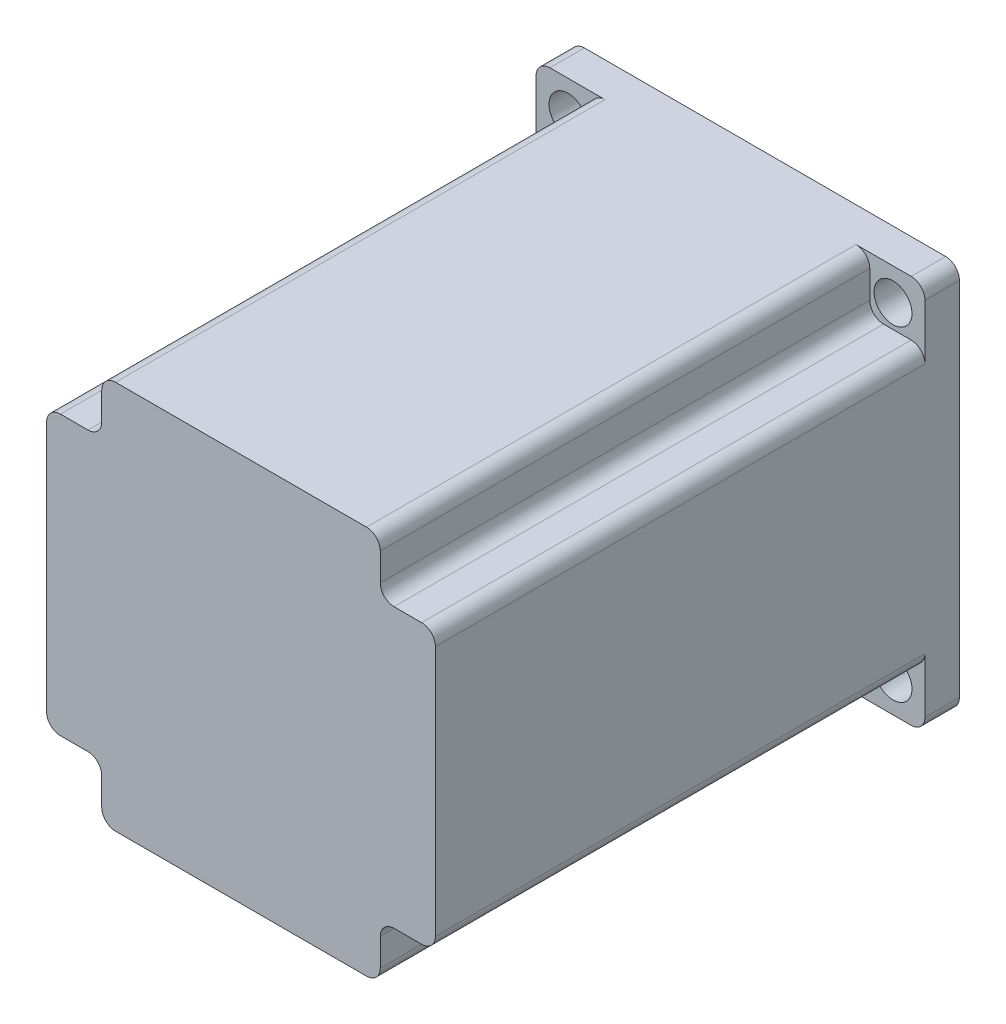
from build123d import *

# Parameters (mm, degrees)
SKETCH1_W        = 56.4
SKETCH1_H        = 56.4
EXTRUSION1_DEPTH = 76
THREAD4_D        = 5.5
THREAD4_DEPTH    = 8
THREAD4_TIP      = 1.652366702
SKETCH4_R        = 19.05
EXTRUSION2_DEPTH = 1.6
SKETCH5_R        = 3.175
EXTRUSION3_DEPTH = 21
SKETCH6_W        = 8
SKETCH6_H        = 8
EXTRUSION4_DEPTH = 71
FILLET1_R        = 2
FILLET2_R        = 2


with BuildPart() as part:
    # Sketch1 → Extrusion1 (new body)
    with BuildSketch(Plane.XY):
        Rectangle(SKETCH1_W, SKETCH1_H)
    extrude(amount=EXTRUSION1_DEPTH)

    # Thread4
    with Locations(Plane(origin=(0, 0, 0), x_dir=(-1, 0, 0), z_dir=(0, 0, -1))):
        with Locations((-23.57, 23.57), (23.57, 23.57), (23.57, -23.57), (-23.57, -23.57)):
            Hole(THREAD4_D / 2, depth=THREAD4_DEPTH)
            with Locations((0, 0, -(THREAD4_DEPTH + THREAD4_TIP / 2))):  # 118° drill point
                Cone(0, THREAD4_D / 2, THREAD4_TIP, mode=Mode.SUBTRACT)

    # Sketch4 → Extrusion2 (add)
    with BuildSketch(Plane(origin=(0, 0, 0), x_dir=(-1, 0, 0), z_dir=(0, 0, -1))):
        with Locations(Location((0, 0, 0), (0, 0, 180))):
            Circle(SKETCH4_R)
    extrude(amount=EXTRUSION2_DEPTH)

    # Sketch5 → Extrusion3 (add)
    with BuildSketch(Plane(origin=(0, 0, -1.6), x_dir=(-1, 0, 0), z_dir=(0, 0, -1))):
        with Locations(Location((0, 0, 0), (0, 0, 180))):
            Circle(SKETCH5_R)
    extrude(amount=EXTRUSION3_DEPTH)

    # Sketch6 → Extrusion4 (cut)
    with BuildSketch(Plane.XY.offset(76)):
        with Locations((-24.2, -24.2)):
            Rectangle(SKETCH6_W, SKETCH6_H)
        with Locations((24.2, -24.2)):
            Rectangle(SKETCH6_W, SKETCH6_H)
        with Locations((24.2, 24.2)):
            Rectangle(SKETCH6_W, SKETCH6_H)
        with Locations((-24.2, 24.2)):
            Rectangle(SKETCH6_W, SKETCH6_H)
    extrude(amount=-EXTRUSION4_DEPTH, mode=Mode.SUBTRACT)

    # Fillet1
    fillet1_edges = [part.edges().sort_by_distance(p)[0] for p in [
        (-28.2, 28.2, 2.5),
    ]]
    fillet(fillet1_edges, radius=FILLET1_R)

    # Fillet2
    fillet2_edges = [part.edges().sort_by_distance(p)[0] for p in [
        (-28.2, -28.2, 2.5),
        (-20.2, -20.2, 40.5),
        (-20.2, -28.2, 40.5),
        (-28.2, -20.2, 40.5),
        (28.2, -28.2, 2.5),
        (20.2, -20.2, 40.5),
        (28.2, -20.2, 40.5),
        (20.2, -28.2, 40.5),
        (28.2, 28.2, 2.5),
        (20.2, 20.2, 40.5),
        (20.2, 28.2, 40.5),
        (28.2, 20.2, 40.5),
        (-20.2, 20.2, 40.5),
        (-28.2, 20.2, 40.5),
        (-20.2, 28.2, 40.5),
    ]]
    fillet(fillet2_edges, radius=FILLET2_R)


solid = part.part
